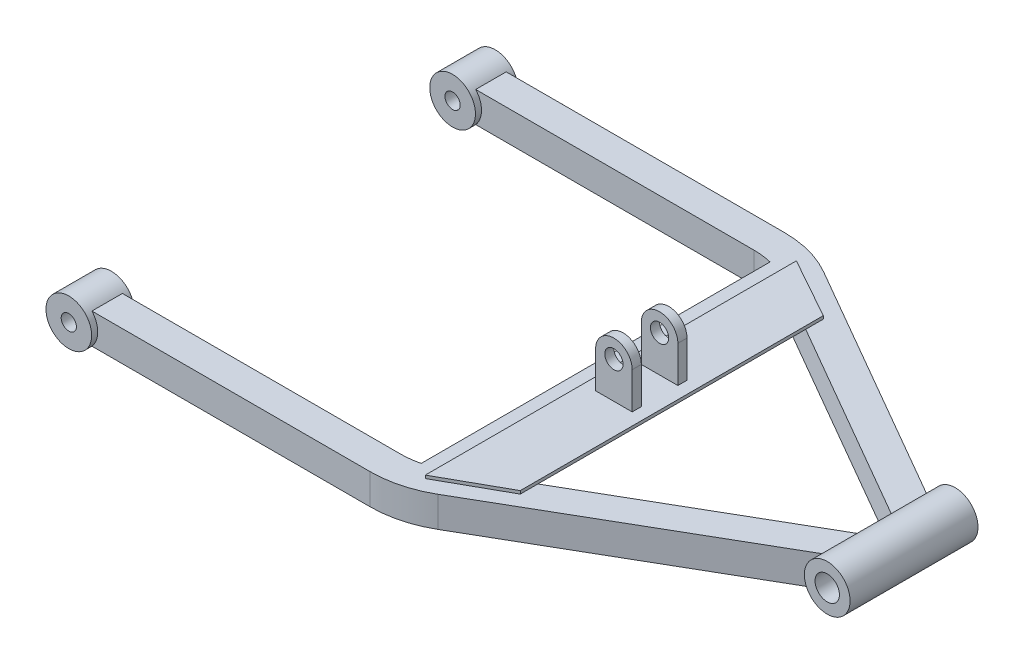
from build123d import *

# Parameters (mm, degrees)
SKETCH2_R                       = 7.5
SKETCH2_R_2                     = 2.5
BOSS_EXTRUDE1_DEPTH             = 7
SKETCH4_R                       = 7.5
SKETCH4_R_2                     = 4
BOSS_EXTRUDE2_DEPTH             = 21
SKETCH3_W                       = 10
SKETCH3_H                       = 10
CUT_EXTRUDE1_DEPTH              = 137
CUT_EXTRUDE1_DEPTH_BACK         = 20
SKETCH2_2_R                     = 2.5
SKETCH4_2_R                     = 4
CUT_EXTRUDE2_DEPTH              = 30
BOSS_EXTRUDE3_REACH             = 221.118
SKETCH5_W                       = 10
SKETCH5_H                       = 10
BOSS_EXTRUDE3_DIRECTION_2_REACH = 221.118
BOSS_EXTRUDE4_DEPTH             = 1
BOSS_EXTRUDE5_START             = 6
SKETCH7_R                       = 3
BOSS_EXTRUDE5_DEPTH             = 3


with BuildPart() as part:
    # Sketch2 → Boss-Extrude1 (new, symmetric)
    with BuildSketch(Plane.XY.offset(-63)):
        Circle(SKETCH2_R)
        Circle(SKETCH2_R_2, mode=Mode.SUBTRACT)
    boss_extrude1 = extrude(amount=BOSS_EXTRUDE1_DEPTH, both=True)



with BuildPart() as body_2:
    # Sketch4 → Boss-Extrude2 (new, symmetric)
    with BuildSketch(Plane.XY):
        with Locations((200, 0)):
            Circle(SKETCH4_R)
        with Locations((200, 0)):
            Circle(SKETCH4_R_2, mode=Mode.SUBTRACT)
    extrude(amount=BOSS_EXTRUDE2_DEPTH, both=True)


with BuildPart() as part_1:
    add(part.part)

    add(body_2.part)  # Sweep1 merges body 2
    # Sweep1: sweep along a path in Sketch1
    with BuildLine(Plane(origin=(0, 0, 0), x_dir=(1, 0, 0), z_dir=(0, 1, 0))) as sweep1_path:
        Line((0, 63), (96.961524227, 63))
        ThreePointArc((96.961524227, 63), (104.72609558, 61.977774789), (111.961524227, 58.980762114))
        Line((111.961524227, 58.980762114), (200, 8.151724427))
    # Sketch3 → Sweep1 (sweep)
    with BuildSketch(Plane(origin=(0, 0, -63), x_dir=(0, 0, -1), z_dir=(1, 0, 0))):
        Rectangle(SKETCH3_W, SKETCH3_H)
    sweep1 = sweep(path=sweep1_path.line)

    # Mirror1: Boss-Extrude1, Sweep1 across plane
    add(boss_extrude1.mirror(Plane.XY))
    add(sweep1.mirror(Plane.XY))

    # Sketch2<2> → Cut-Extrude1 (cut, two sides: drawn at the far end of the back side and taken through both)
    with BuildSketch(Plane.XY.offset(-63).offset(-CUT_EXTRUDE1_DEPTH_BACK)):
        Circle(SKETCH2_2_R)
    extrude(amount=CUT_EXTRUDE1_DEPTH + CUT_EXTRUDE1_DEPTH_BACK, mode=Mode.SUBTRACT)

    # Sketch4<2> → Cut-Extrude2 (cut, symmetric)
    with BuildSketch(Plane.XY):
        with Locations((200, 0)):
            Circle(SKETCH4_2_R)
    extrude(amount=CUT_EXTRUDE2_DEPTH, both=True, mode=Mode.SUBTRACT)

    # Sketch5 → Boss-Extrude3 (add, up to next)
    with BuildSketch(Plane.XY, mode=Mode.PRIVATE) as boss_extrude3_sk1:
        with Locations((107.961524227, 0)):
            Rectangle(SKETCH5_W, SKETCH5_H)
    boss_extrude3_tool1 = extrude(boss_extrude3_sk1.sketch, amount=BOSS_EXTRUDE3_REACH, mode=Mode.PRIVATE) - part_1.part
    add(boss_extrude3_tool1.solids().sort_by_distance((107.961524, 0, 0))[0])

    # Sketch5 → Boss-Extrude3 direction 2 (add, up to next)
    with BuildSketch(Plane.XY, mode=Mode.PRIVATE) as boss_extrude3_direction_2_sk1:
        with Locations((107.961524227, 0)):
            Rectangle(SKETCH5_W, SKETCH5_H)
    boss_extrude3_direction_2_tool1 = extrude(boss_extrude3_direction_2_sk1.sketch, amount=-BOSS_EXTRUDE3_DIRECTION_2_REACH, mode=Mode.PRIVATE) - part_1.part
    add(boss_extrude3_direction_2_tool1.solids().sort_by_distance((107.961524, 0, 0))[0])

    # Sketch6 → Boss-Extrude4 (add)
    with BuildSketch(Plane(origin=(0, 5, 0), x_dir=(1, 0, 0), z_dir=(0, 1, 0))):
        Polygon((107.961524227, 60.910571474), (107.961524227, -60.910571474), (127.961524227, -49.743157806), (127.961524227, 49.743157806), align=None)
    extrude(amount=BOSS_EXTRUDE4_DEPTH)

    # Sketch7 → Boss-Extrude5 (add)
    with BuildSketch(Plane.XY.offset(BOSS_EXTRUDE5_START)):
        with BuildLine():
            Line((111.961524227, 6), (111.961524227, 18))
            ThreePointArc((111.961524227, 18), (117.961524227, 24), (123.961524227, 18))
            Line((123.961524227, 18), (123.961524227, 6))
            Line((123.961524227, 6), (111.961524227, 6))
        make_face()
        with Locations((117.961524227, 18)):
            Circle(SKETCH7_R, mode=Mode.SUBTRACT)
    boss_extrude5 = extrude(amount=BOSS_EXTRUDE5_DEPTH)

    # Mirror2: Boss-Extrude5 across plane
    add(boss_extrude5.mirror(Plane.XY))


solid = part_1.part
